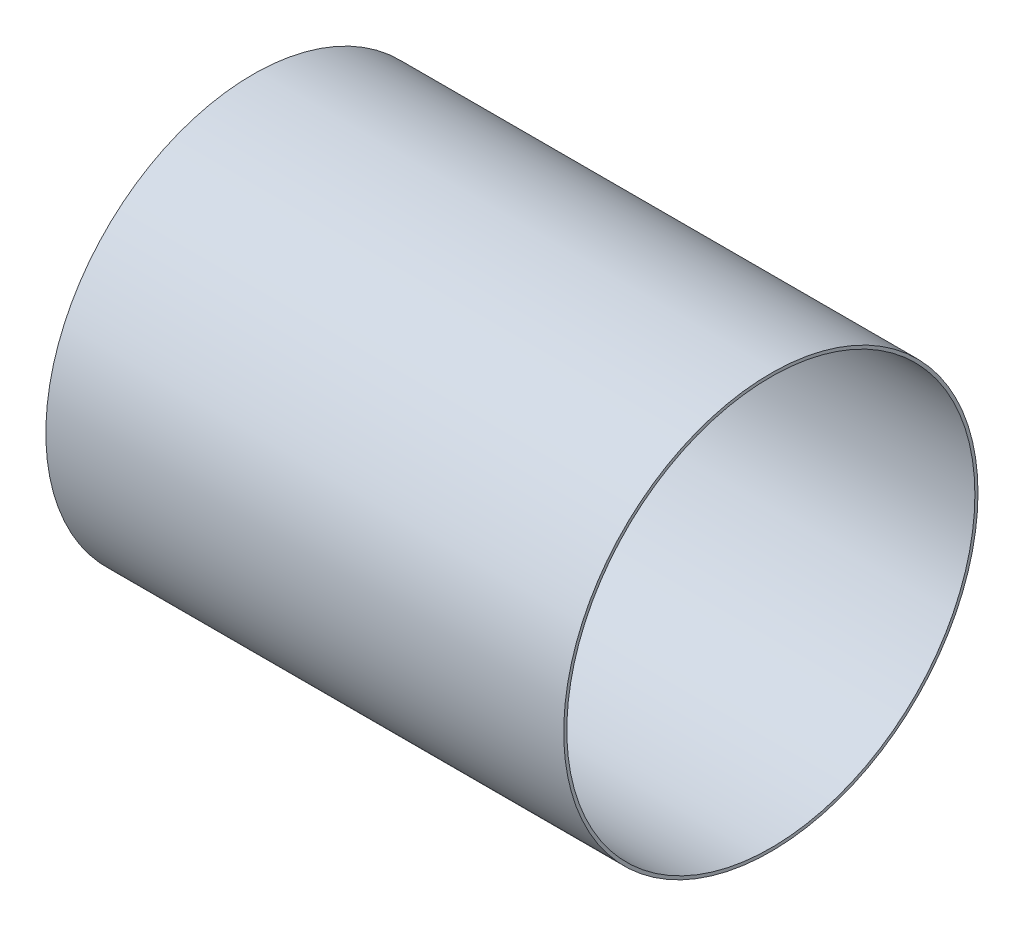
from build123d import *

# Parameters (mm, degrees)
SKETCH1_R           = 200
SKETCH1_R_2         = 197
BOSS_EXTRUDE1_DEPTH = 500


with BuildPart() as part:
    # Sketch1 → Boss-Extrude1 (new body)
    with BuildSketch(Plane(origin=(0, 0, 0), x_dir=(0, 0, -1), z_dir=(1, 0, 0))):
        Circle(SKETCH1_R)
        Circle(SKETCH1_R_2, mode=Mode.SUBTRACT)
    extrude(amount=BOSS_EXTRUDE1_DEPTH)


solid = part.part
